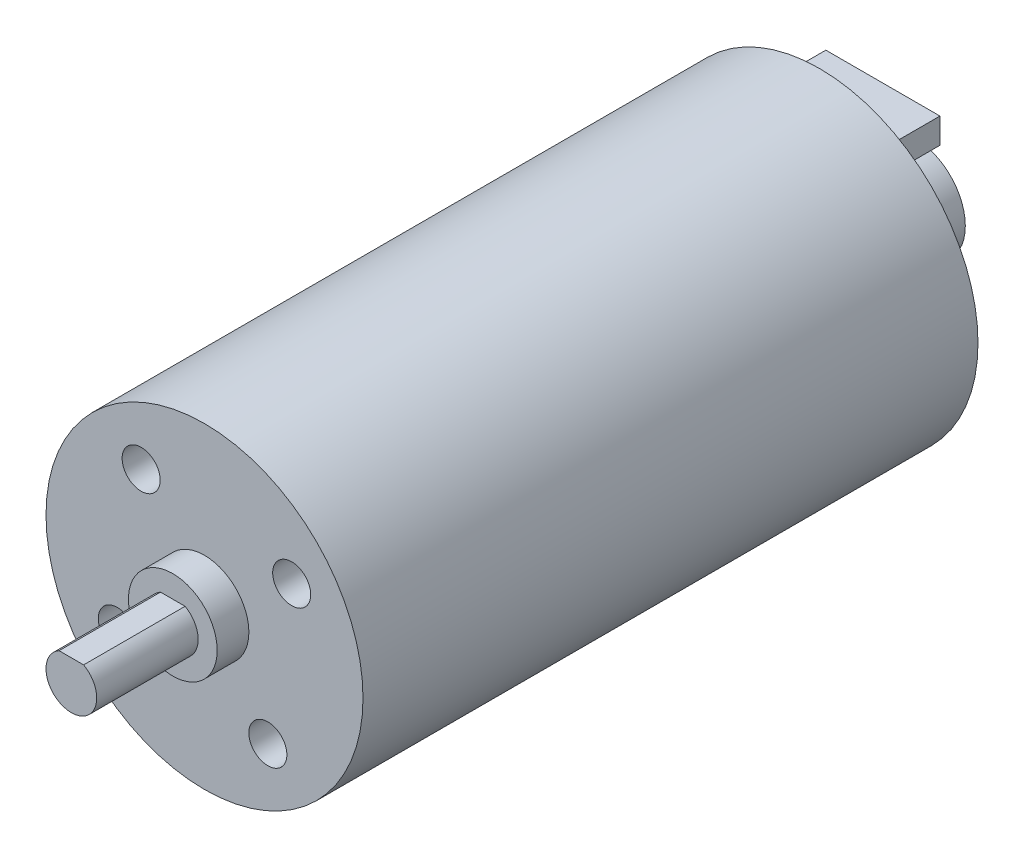
from build123d import *

# Parameters (mm, degrees)
SKETCH_1_R          = 12.5
EXTRUDE_1_DEPTH     = 48.5
SKETCH_2_R          = 3.5
EXTRUDE_2_DEPTH     = 2.5
SKETCH_3_R          = 2
EXTRUDE_3_DEPTH     = 8
SKETCH_4_W          = 3.587297211
SKETCH_4_H          = 1.292719716
CUT_EXTRUDE_1_DEPTH = 8
SKETCH_5_R          = 1.5
CUT_EXTRUDE_2_DEPTH = 8
SKETCH_6_R          = 4
EXTRUDE_4_DEPTH     = 7.5
SKETCH_7_W          = 9
SKETCH_7_H          = 2
EXTRUDE_5_DEPTH     = 5


with BuildPart() as part:
    # 草图1 → 凸台-拉伸1 (new body)
    with BuildSketch(Plane.XY):
        with Locations(Location((0, 0, 0), (0, 0, 180))):
            Circle(SKETCH_1_R)
    extrude(amount=EXTRUDE_1_DEPTH)

    # 草图2 → 凸台-拉伸2 (add)
    with BuildSketch(Plane.XY.offset(48.5)):
        Circle(SKETCH_2_R)
    extrude(amount=EXTRUDE_2_DEPTH)

    # 草图3 → 凸台-拉伸3 (add)
    with BuildSketch(Plane.XY.offset(51)):
        Circle(SKETCH_3_R)
    extrude(amount=EXTRUDE_3_DEPTH)

    # 草图4 → 切除-拉伸1 (cut)
    with BuildSketch(Plane.XY.offset(59)):
        with Locations((0.022725356, 2.396212297)):
            Rectangle(SKETCH_4_W, SKETCH_4_H)
    extrude(amount=-CUT_EXTRUDE_1_DEPTH, mode=Mode.SUBTRACT)

    # 草图5 → 切除-拉伸2 (cut)
    with BuildSketch(Plane.XY.offset(48.5)):
        with Locations((4.996399446, -6.876481118)):
            Circle(SKETCH_5_R)
        with Locations((-6.876481118, -4.996399446)):
            Circle(SKETCH_5_R)
        with Locations((-4.996399446, 6.876481118)):
            Circle(SKETCH_5_R)
        with Locations((6.876481118, 4.996399446)):
            Circle(SKETCH_5_R)
    extrude(amount=-CUT_EXTRUDE_2_DEPTH, mode=Mode.SUBTRACT)

    # 草图6 → 凸台-拉伸4 (add)
    with BuildSketch(Plane(origin=(0, 0, 0), x_dir=(-1, 0, 0), z_dir=(0, 0, -1))):
        with Locations(Location((0, 0, 0), (0, 0, 180))):
            Circle(SKETCH_6_R)
    extrude(amount=EXTRUDE_4_DEPTH)

    # 草图7 → 凸台-拉伸5 (add)
    with BuildSketch(Plane(origin=(0, 0, 0), x_dir=(-1, 0, 0), z_dir=(0, 0, -1))):
        with Locations((0, 8)):
            Rectangle(SKETCH_7_W, SKETCH_7_H)
        with Locations((0, -8)):
            Rectangle(SKETCH_7_W, SKETCH_7_H)
    extrude(amount=EXTRUDE_5_DEPTH)


solid = part.part
